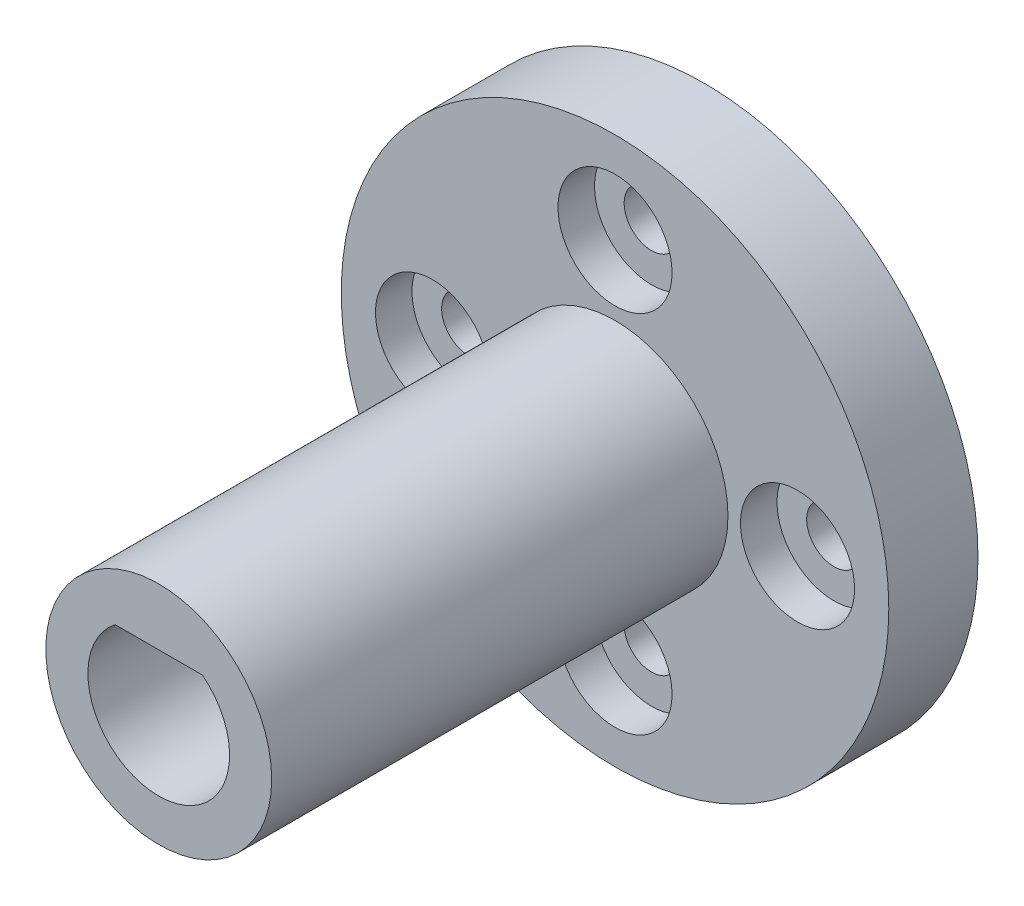
from build123d import *

# Parameters (mm, degrees)
ESQUISSE1_R                                        = 12
BOSS_EXTRU_1_DEPTH                                 = 3.91
ESQUISSE6_R                                        = 4
ENL_V_MAT_EXTRU_2_DEPTH                            = 1.91
ESQUISSE7_R                                        = 4.95
BOSS_EXTRU_2_DEPTH                                 = 20
CHAMBRAGE_POUR_VIS_T_TE_RONDE_BOMB_E_M_D           = 2.4
CHAMBRAGE_POUR_VIS_T_TE_RONDE_BOMB_E_M_CBORE_D     = 5
CHAMBRAGE_POUR_VIS_T_TE_RONDE_BOMB_E_M_CBORE_DEPTH = 1.6
R_P_TITION_CIRCULAIRE2_COUNT                       = 4


with BuildPart() as part:
    # Esquisse1 → Boss.-Extru.1 (new body)
    with BuildSketch(Plane.XY):
        Circle(ESQUISSE1_R)
    extrude(amount=BOSS_EXTRU_1_DEPTH)

    # Esquisse6 → Enlèv. mat.-Extru.2 (cut)
    with BuildSketch(Plane(origin=(0, 0, 0), x_dir=(-1, 0, 0), z_dir=(0, 0, -1))):
        Circle(ESQUISSE6_R)
    extrude(amount=-ENL_V_MAT_EXTRU_2_DEPTH, mode=Mode.SUBTRACT)

    # Esquisse7 → Boss.-Extru.2 (add)
    with BuildSketch(Plane.XY.offset(3.91)):
        Circle(ESQUISSE7_R)
        with BuildLine():
            Line((1.913896549, 2.445), (-1.913896549, 2.445))
            ThreePointArc((-1.913896549, 2.445), (0, -3.105), (1.913896549, 2.445))
        make_face(mode=Mode.SUBTRACT)
    extrude(amount=BOSS_EXTRU_2_DEPTH)

    # Chambrage pour vis à tête ronde bombée M21 (through all)
    with Locations(Plane.XY.offset(3.91)):
        with Locations((0, 8)):
            chambrage_pour_vis_t_te_ronde_bomb_e_m = CounterBoreHole(CHAMBRAGE_POUR_VIS_T_TE_RONDE_BOMB_E_M_D / 2, CHAMBRAGE_POUR_VIS_T_TE_RONDE_BOMB_E_M_CBORE_D / 2, CHAMBRAGE_POUR_VIS_T_TE_RONDE_BOMB_E_M_CBORE_DEPTH)

    # Répétition circulaire2: Chambrage pour vis à tête ronde bombée M21 ×4 about axis
    r_p_tition_circulaire2_axis = Axis((0, 0, 0), (0, 0, 1))
    for i in range(1, R_P_TITION_CIRCULAIRE2_COUNT):
        add(chambrage_pour_vis_t_te_ronde_bomb_e_m.rotate(r_p_tition_circulaire2_axis, i * 360 / R_P_TITION_CIRCULAIRE2_COUNT), mode=Mode.SUBTRACT)


solid = part.part
